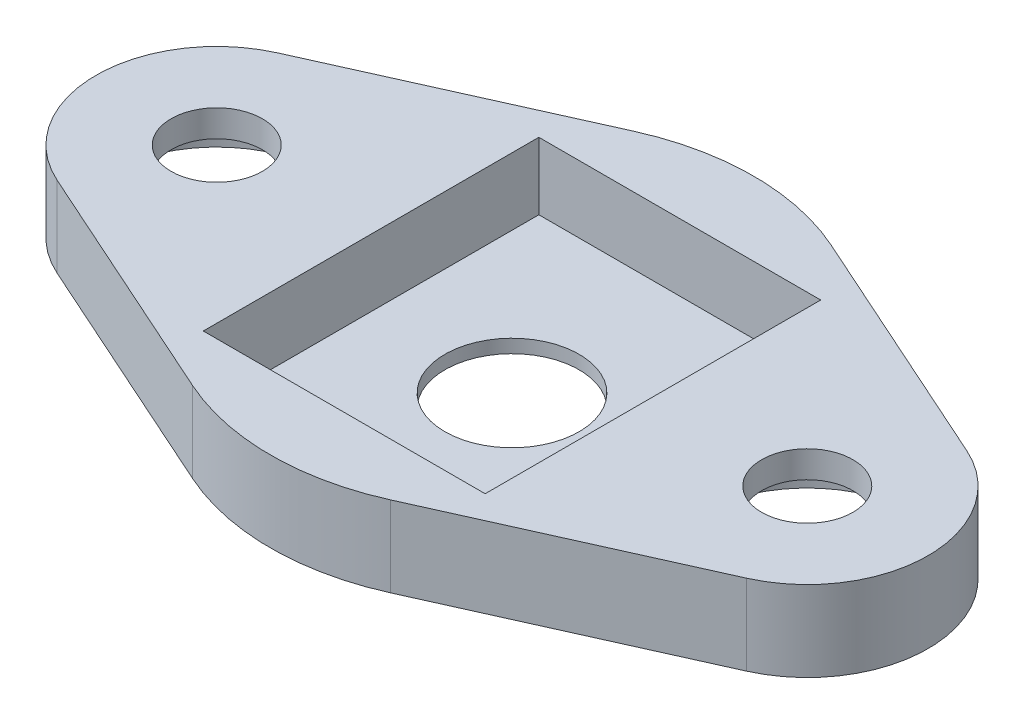
from build123d import *

# Parameters (mm, degrees)
SKETCH1_R           = 1.7
SKETCH1_R_2         = 2.5
BOSS_EXTRUDE1_DEPTH = 3
SKETCH1_11_R        = 4.15
CUT_EXTRUDE1_DEPTH  = 2
CUT_EXTRUDE2_START  = 0.5
CUT_EXTRUDE2_DEPTH  = 2.5


with BuildPart() as part:
    # Sketch1 → Boss-Extrude1 (new body)
    with BuildSketch(Plane(origin=(0, 0, 0), x_dir=(1, 0, 0), z_dir=(0, 1, 0))):
        with BuildLine():
            Line((12.840909091, 4.106221343), (3.681818182, 8.212442686))
            ThreePointArc((3.681818182, 8.212442686), (0, 9), (-3.681818182, 8.212442686))
            Line((-3.681818182, 8.212442686), (-12.840909091, 4.106221343))
            ThreePointArc((-12.840909091, 4.106221343), (-15.5, 0), (-12.840909091, -4.106221343))
            Line((-12.840909091, -4.106221343), (-3.681818182, -8.212442686))
            ThreePointArc((-3.681818182, -8.212442686), (0, -9), (3.681818182, -8.212442686))
            Line((3.681818182, -8.212442686), (12.840909091, -4.106221343))
            ThreePointArc((12.840909091, -4.106221343), (15.5, 0), (12.840909091, 4.106221343))
        make_face()
        with Locations(Location((-11, 0, 0), (0, 0, 270))):
            Circle(SKETCH1_R, mode=Mode.SUBTRACT)
        with Locations(Location((0, 0, 0), (0, 0, 270))):
            Circle(SKETCH1_R_2, mode=Mode.SUBTRACT)
        with Locations(Location((11, 0, 0), (0, 0, 270))):
            Circle(SKETCH1_R, mode=Mode.SUBTRACT)
    extrude(amount=BOSS_EXTRUDE1_DEPTH)

    # Sketch1<11> → Cut-Extrude1 (cut)
    with BuildSketch(Plane(origin=(0, 0, 0), x_dir=(1, 0, 0), z_dir=(0, 1, 0))):
        with Locations(Location((-11, 0, 0), (0, 0, 270))):
            Circle(SKETCH1_11_R)
        with Locations(Location((11, 0, 0), (0, 0, 270))):
            Circle(SKETCH1_11_R)
    extrude(amount=CUT_EXTRUDE1_DEPTH, mode=Mode.SUBTRACT)

    # Sketch1<12> → Cut-Extrude2 (cut)
    with BuildSketch(Plane(origin=(0, 0, 0), x_dir=(1, 0, 0), z_dir=(0, 1, 0)).offset(CUT_EXTRUDE2_START)):
        with BuildLine():
            Line((-5.25, 6.25), (-5.25, 0))
            Line((-5.25, 0), (-2.5, 0))
            ThreePointArc((-2.5, 0), (0, 2.5), (2.5, 0))
            Line((2.5, 0), (5.25, 0))
            Line((5.25, 0), (5.25, 6.25))
            Line((5.25, 6.25), (-5.25, 6.25))
        make_face()
        with BuildLine():
            Line((-2.5, 0), (-5.25, 0))
            Line((-5.25, 0), (-5.25, -6.25))
            Line((-5.25, -6.25), (5.25, -6.25))
            Line((5.25, -6.25), (5.25, 0))
            Line((5.25, 0), (2.5, 0))
            ThreePointArc((2.5, 0), (0, -2.5), (-2.5, 0))
        make_face()
    extrude(amount=CUT_EXTRUDE2_DEPTH, mode=Mode.SUBTRACT)


solid = part.part
